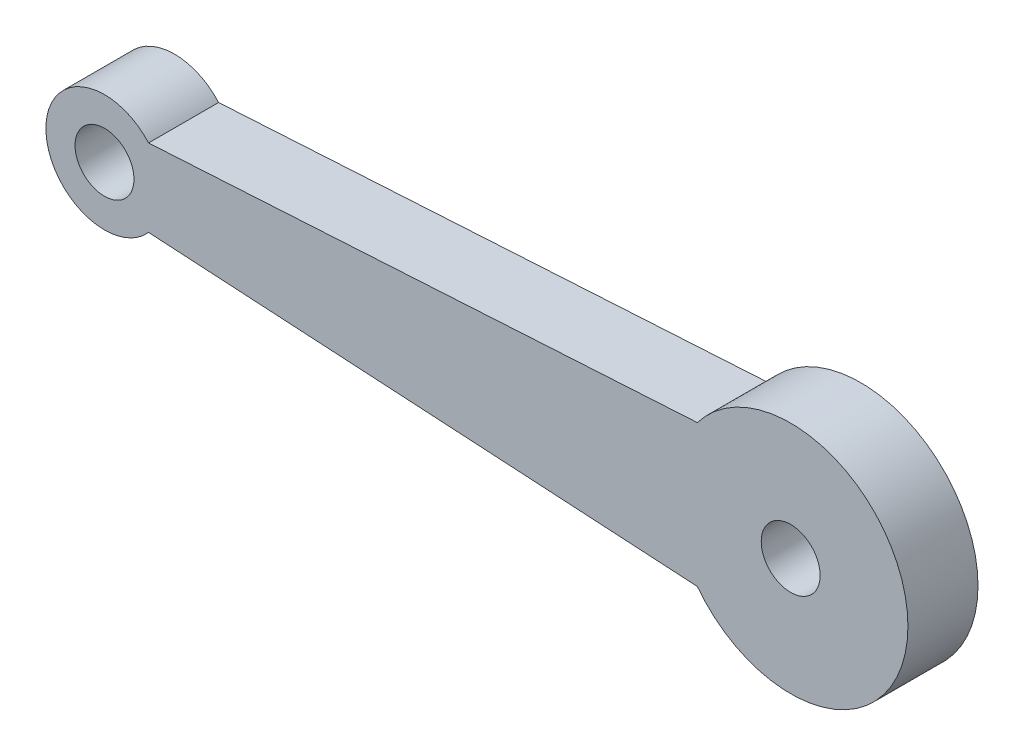
from build123d import *

# Parameters (mm, degrees)
SKETCH1_R           = 5.025
BOSS_EXTRUDE1_DEPTH = 11.95


with BuildPart() as part:
    # Sketch1 → Boss-Extrude1 (new body)
    with BuildSketch(Plane.XY):
        with BuildLine():
            Line((46.4909135, -12.105247864), (-47.113801334, -6.605207658))
            ThreePointArc((-47.113801334, -6.605207658), (-64.621879103, 0), (-47.113801334, 6.605207658))
            Line((-47.113801334, 6.605207658), (46.4909135, 12.105247864))
            ThreePointArc((46.4909135, 12.105247864), (82.411434037, 0), (46.4909135, -12.105247864))
        make_face()
        with Locations(Location((-54.621879103, 0, 0), (0, 0, 180))):
            Circle(SKETCH1_R, mode=Mode.SUBTRACT)
        with Locations(Location((62.411434037, 0, 0), (0, 0, 180))):
            Circle(SKETCH1_R, mode=Mode.SUBTRACT)
    extrude(amount=BOSS_EXTRUDE1_DEPTH)


solid = part.part
